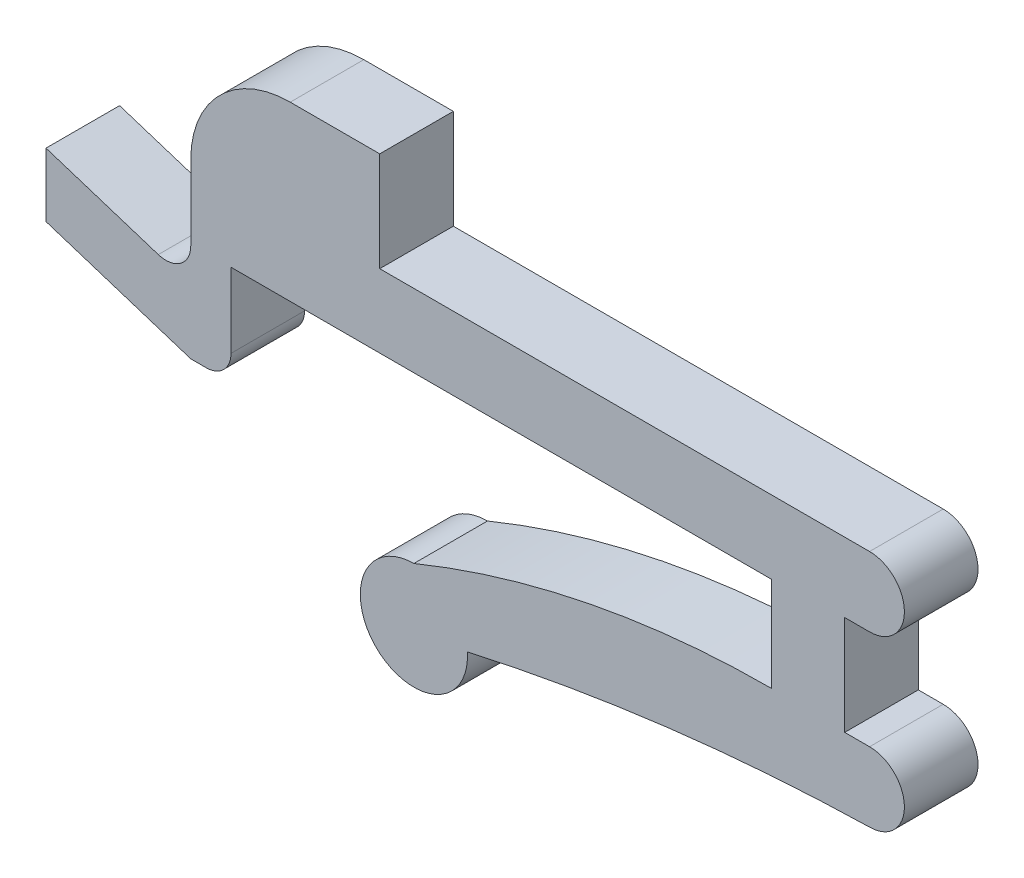
from build123d import *

# Parameters (mm, degrees)
BOSS_EXTRUDE1_DEPTH = 37.592
FILLET1_R           = 12.7
FILLET2_R           = 50.8
FILLET3_R           = 12.7
SCALE1_SCALE        = 0.05


with BuildPart() as part:
    # Sketch1 → Boss-Extrude1 (new body)
    with BuildSketch(Plane.XY):
        with BuildLine():
            Line((0, 109.420372667), (250.19, 109.420372667))
            ThreePointArc((250.19, 109.420372667), (267.97, 91.640372667), (250.19, 73.860372667))
            Line((250.19, 73.860372667), (237.49, 73.860372667))
            Line((237.49, 73.860372667), (237.49, 23.060372667))
            Line((237.49, 23.060372667), (250.19, 23.060372667))
            ThreePointArc((250.19, 23.060372667), (267.97, 5.280372667), (250.19, -12.499627333))
            ThreePointArc((250.19, -12.499627333), (146.843102498, -20.027410993), (44.744230284, -37.721168163))
            ThreePointArc((44.744230284, -37.721168163), (-1.227067533, -59.631780483), (17.441932467, -12.25136687))
            ThreePointArc((17.441932467, -12.25136687), (107.033415037, 14.717722357), (200.152, 23.822372667))
            Line((200.152, 23.822372667), (200.152, 72.082372667))
            Line((200.152, 72.082372667), (-75.968392762, 72.082372667))
            Line((-75.968392762, 72.082372667), (-75.968392762, 21.282372667))
            Line((-75.968392762, 21.282372667), (-96.52, 21.282372667))
            Line((-96.52, 21.282372667), (-170.457211488, 45.010876589))
            Line((-170.457211488, 45.010876589), (-170.457211488, 77.522876589))
            Line((-170.457211488, 77.522876589), (-96.52, 53.794372667))
            Line((-96.52, 53.794372667), (-96.52, 139.901603313))
            Line((-96.52, 139.901603313), (-96.52, 160.220372667))
            Line((-96.52, 160.220372667), (0, 160.220372667))
            Line((0, 160.220372667), (0, 109.420372667))
        make_face()
    extrude(amount=BOSS_EXTRUDE1_DEPTH)

    # Fillet1
    fillet1_edges = [part.edges().sort_by_distance(p)[0] for p in [
        (-75.968392762, 21.282372667, 18.796),
    ]]
    fillet(fillet1_edges, radius=FILLET1_R)

    # Fillet2
    fillet2_edges = [part.edges().sort_by_distance(p)[0] for p in [
        (-96.52, 160.220372667, 18.796),
    ]]
    fillet(fillet2_edges, radius=FILLET2_R)

    # Fillet3
    fillet3_edges = [part.edges().sort_by_distance(p)[0] for p in [
        (-96.52, 53.794372667, 18.796),
    ]]
    fillet(fillet3_edges, radius=FILLET3_R)


with BuildPart() as part_1:
    # Scale1: scaled about (66.164273322, 56.765113867, 18.796)
    add(part.part.scale(SCALE1_SCALE).moved(Location((62.856059656, 53.926858174, 17.8562))))


solid = part_1.part
